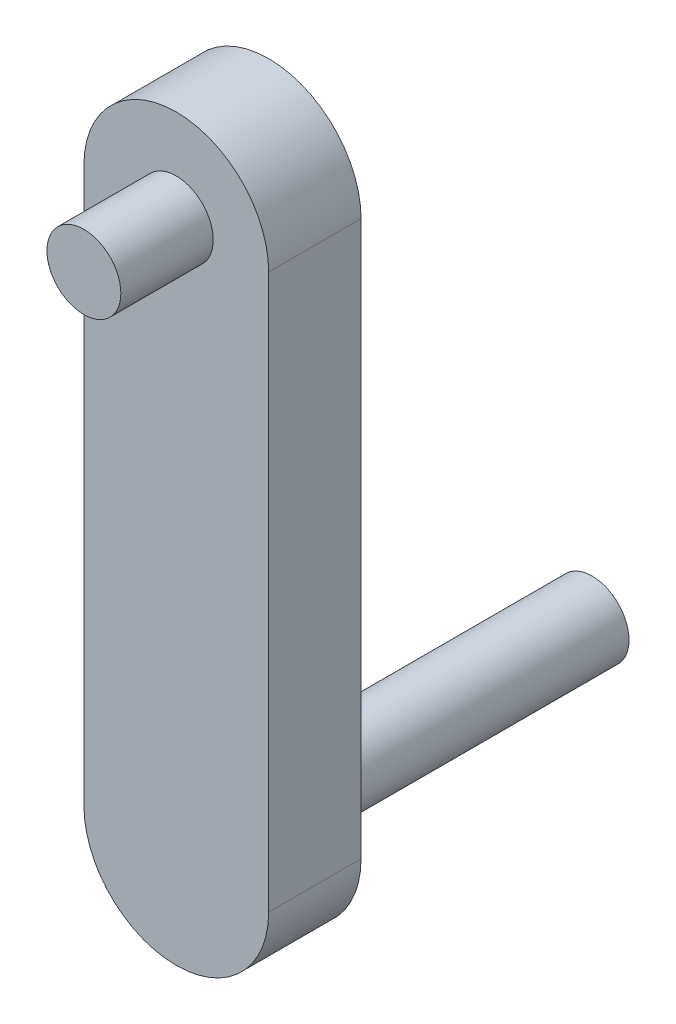
from build123d import *

# Parameters (mm, degrees)
SKETCH1_R           = 4
BOSS_EXTRUDE1_DEPTH = 10
SKETCH1_2_R         = 4
BOSS_EXTRUDE2_DEPTH = 20
BOSS_EXTRUDE3_START = -35
SKETCH1_3_R         = 4
BOSS_EXTRUDE3_DEPTH = 45


with BuildPart() as part:
    # Sketch1 → Boss-Extrude1 (new body)
    with BuildSketch(Plane.XY):
        with BuildLine():
            Line((10, 30), (10, -30))
            ThreePointArc((10, -30), (0, -40), (-10, -30))
            Line((-10, -30), (-10, 30))
            ThreePointArc((-10, 30), (0, 40), (10, 30))
        make_face()
        with Locations((0, 30)):
            Circle(SKETCH1_R, mode=Mode.SUBTRACT)
        with Locations((0, -30)):
            Circle(SKETCH1_R, mode=Mode.SUBTRACT)
    extrude(amount=BOSS_EXTRUDE1_DEPTH)

    # Sketch1<2> → Boss-Extrude2 (add)
    with BuildSketch(Plane.XY):
        with Locations((0, 30)):
            Circle(SKETCH1_2_R)
    extrude(amount=BOSS_EXTRUDE2_DEPTH)

    # Sketch1<3> → Boss-Extrude3 (add)
    with BuildSketch(Plane.XY.offset(BOSS_EXTRUDE3_START)):
        with Locations((0, -30)):
            Circle(SKETCH1_3_R)
    extrude(amount=BOSS_EXTRUDE3_DEPTH)


solid = part.part
